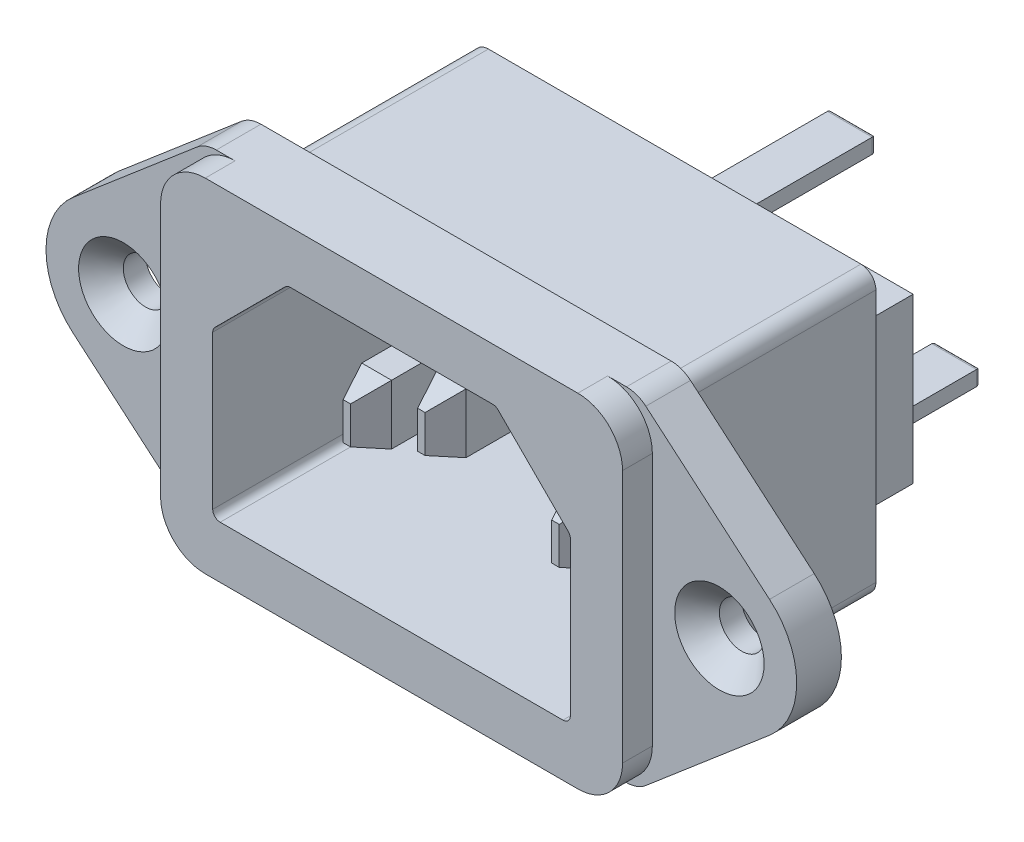
from build123d import *
from OCP.BRepFilletAPI import BRepFilletAPI_MakeChamfer

# Parameters (mm, degrees)
SKIZZE1_R                       = 1.5
AUFSATZ_LINEAR_AUSTRAGEN1_DEPTH = 3
VERRUNDUNG1_R                   = 2
FASE1_SIZE                      = 1.5
AUFSATZ_LINEAR_AUSTRAGEN2_DEPTH = 2
AUFSATZ_LINEAR_AUSTRAGEN3_DEPTH = 14
SCHNITT_LINEAR_AUSTRAGEN1_DEPTH = 17
SKIZZE5_W                       = 24
SKIZZE5_H                       = 11
AUFSATZ_LINEAR_AUSTRAGEN4_DEPTH = 4
SKIZZE6_W                       = 3
SKIZZE6_H                       = 1
AUFSATZ_LINEAR_AUSTRAGEN5_DEPTH = 8
SKIZZE7_W                       = 2
SKIZZE7_H                       = 4
AUFSATZ_LINEAR_AUSTRAGEN6_DEPTH = 13
SKIZZE8_W                       = 2
SKIZZE8_H                       = 4
AUFSATZ_LINEAR_AUSTRAGEN7_DEPTH = 15
FASE2_SIZE                      = 2
FASE2_SIZE2                     = 0.75
VERRUNDUNG2_R                   = 0.25


with BuildPart() as part:
    # Skizze1 → Aufsatz-Linear austragen1 (new body)
    with BuildSketch(Plane.XY):
        with BuildLine():
            ThreePointArc((23.364069952, 3.949125596), (25.187731645, 0), (23.364069952, -3.949125596))
            Line((23.364069952, -3.949125596), (14.5, -11.5))
            Line((14.5, -11.5), (-14.5, -11.5))
            Line((-14.5, -11.5), (-23.364069952, -3.949125596))
            ThreePointArc((-23.364069952, -3.949125596), (-25.187731645, 0), (-23.364069952, 3.949125596))
            Line((-23.364069952, 3.949125596), (-14.5, 11.5))
            Line((-14.5, 11.5), (14.5, 11.5))
            Line((14.5, 11.5), (23.364069952, 3.949125596))
        make_face()
        with Locations((20, 0)):
            Circle(SKIZZE1_R, mode=Mode.SUBTRACT)
        with Locations((-20, 0)):
            Circle(SKIZZE1_R, mode=Mode.SUBTRACT)
    extrude(amount=AUFSATZ_LINEAR_AUSTRAGEN1_DEPTH)

    # Verrundung1
    verrundung1_edges = [part.edges().sort_by_distance(p)[0] for p in [
        (14.5, -11.5, 1.5),
        (-14.5, -11.5, 1.5),
        (-14.5, 11.5, 1.5),
        (14.5, 11.5, 1.5),
    ]]
    fillet(verrundung1_edges, radius=VERRUNDUNG1_R)

    # Fase1
    fase1_edges = [part.edges().sort_by_distance(p)[0] for p in [
        (18.5, 0, 3),
        (-21.5, 0, 3),
    ]]
    chamfer(fase1_edges, length=FASE1_SIZE)

    # Skizze2 → Aufsatz-Linear austragen2 (add)
    with BuildSketch(Plane.XY.offset(3)):
        with BuildLine():
            Line((-12.5, -11.5), (12.5, -11.5))
            ThreePointArc((12.5, -11.5), (14.621320344, -10.621320344), (15.5, -8.5))
            Line((15.5, -8.5), (15.5, 8.5))
            ThreePointArc((15.5, 8.5), (14.621320344, 10.621320344), (12.5, 11.5))
            Line((12.5, 11.5), (-12.5, 11.5))
            ThreePointArc((-12.5, 11.5), (-14.621320344, 10.621320344), (-15.5, 8.5))
            Line((-15.5, 8.5), (-15.5, -8.5))
            ThreePointArc((-15.5, -8.5), (-14.621320344, -10.621320344), (-12.5, -11.5))
        make_face()
    extrude(amount=AUFSATZ_LINEAR_AUSTRAGEN2_DEPTH)

    # Skizze4 → Aufsatz-Linear austragen3 (add)
    with BuildSketch(Plane(origin=(0, 0, 0), x_dir=(-1, 0, 0), z_dir=(0, 0, -1))):
        with BuildLine():
            Line((12.5, -9.5), (-12.5, -9.5))
            ThreePointArc((-12.5, -9.5), (-13.207106781, -9.207106781), (-13.5, -8.5))
            Line((-13.5, -8.5), (-13.5, 8.5))
            ThreePointArc((-13.5, 8.5), (-13.207106781, 9.207106781), (-12.5, 9.5))
            Line((-12.5, 9.5), (12.5, 9.5))
            ThreePointArc((12.5, 9.5), (13.207106781, 9.207106781), (13.5, 8.5))
            Line((13.5, 8.5), (13.5, -8.5))
            ThreePointArc((13.5, -8.5), (13.207106781, -9.207106781), (12.5, -9.5))
        make_face()
    extrude(amount=AUFSATZ_LINEAR_AUSTRAGEN3_DEPTH)

    # Skizze3 → Schnitt-Linear austragen1 (cut)
    with BuildSketch(Plane.XY.offset(5)):
        with BuildLine():
            Line((11.5, -8), (-11.5, -8))
            ThreePointArc((-11.5, -8), (-11.853553391, -7.853553391), (-12, -7.5))
            Line((-12, -7.5), (-12, 2.792893219))
            ThreePointArc((-12, 2.792893219), (-11.961939766, 2.984234935), (-11.853553391, 3.146446609))
            Line((-11.853553391, 3.146446609), (-7.146446609, 7.853553391))
            ThreePointArc((-7.146446609, 7.853553391), (-6.984234935, 7.961939766), (-6.792893219, 8))
            Line((-6.792893219, 8), (6.792893219, 8))
            ThreePointArc((6.792893219, 8), (6.984234935, 7.961939766), (7.146446609, 7.853553391))
            Line((7.146446609, 7.853553391), (11.853553391, 3.146446609))
            ThreePointArc((11.853553391, 3.146446609), (11.961939766, 2.984234935), (12, 2.792893219))
            Line((12, 2.792893219), (12, -7.5))
            ThreePointArc((12, -7.5), (11.853553391, -7.853553391), (11.5, -8))
        make_face()
    extrude(amount=-SCHNITT_LINEAR_AUSTRAGEN1_DEPTH, mode=Mode.SUBTRACT)

    # Skizze5 → Aufsatz-Linear austragen4 (add)
    with BuildSketch(Plane(origin=(0, 0, -14), x_dir=(-1, 0, 0), z_dir=(0, 0, -1))):
        Rectangle(SKIZZE5_W, SKIZZE5_H)
    extrude(amount=AUFSATZ_LINEAR_AUSTRAGEN4_DEPTH)

    # Skizze6 → Aufsatz-Linear austragen5 (add)
    with BuildSketch(Plane(origin=(0, 0, -18), x_dir=(-1, 0, 0), z_dir=(0, 0, -1))):
        with Locations((0, 5)):
            Rectangle(SKIZZE6_W, SKIZZE6_H)
        with Locations((-7, -5)):
            Rectangle(SKIZZE6_W, SKIZZE6_H)
        with Locations((7, -5)):
            Rectangle(SKIZZE6_W, SKIZZE6_H)
    extrude(amount=AUFSATZ_LINEAR_AUSTRAGEN5_DEPTH)

    # Skizze7 → Aufsatz-Linear austragen6 (add)
    with BuildSketch(Plane.XY.offset(-12)):
        with Locations((-7, -2)):
            Rectangle(SKIZZE7_W, SKIZZE7_H)
        with Locations((7, -2)):
            Rectangle(SKIZZE7_W, SKIZZE7_H)
    extrude(amount=AUFSATZ_LINEAR_AUSTRAGEN6_DEPTH)

    # Skizze8 → Aufsatz-Linear austragen7 (add)
    with BuildSketch(Plane.XY.offset(-12)):
        with Locations((0, 2)):
            Rectangle(SKIZZE8_W, SKIZZE8_H)
    extrude(amount=AUFSATZ_LINEAR_AUSTRAGEN7_DEPTH)

    # Fase2: one chamfer whose edges measure the first distance from different faces: ONE call of the kernel's chamfer builder (chamfer() names one face for all edges)
    fase2_edges_1 = [part.edges().sort_by_distance(p)[0] for p in [
        (7, -4, 1),
    ]]
    fase2_side_1 = [part.faces().sort_by_distance(p)[0] for p in [
        (7, -4, -5.5),
    ]]
    fase2_edges_2 = [part.edges().sort_by_distance(p)[0] for p in [
        (6, -2, 1),
    ]]
    fase2_side_2 = [part.faces().sort_by_distance(p)[0] for p in [
        (6, -2, -5.5),
    ]]
    fase2_edges_3 = [part.edges().sort_by_distance(p)[0] for p in [
        (7, 0, 1),
    ]]
    fase2_side_3 = [part.faces().sort_by_distance(p)[0] for p in [
        (7, 0, -5.5),
    ]]
    fase2_edges_4 = [part.edges().sort_by_distance(p)[0] for p in [
        (8, -2, 1),
    ]]
    fase2_side_4 = [part.faces().sort_by_distance(p)[0] for p in [
        (8, -2, -5.5),
    ]]
    fase2_edges_5 = [part.edges().sort_by_distance(p)[0] for p in [
        (0, 0, 3),
    ]]
    fase2_side_5 = [part.faces().sort_by_distance(p)[0] for p in [
        (0, 0, -4.5),
    ]]
    fase2_edges_6 = [part.edges().sort_by_distance(p)[0] for p in [
        (-1, 2, 3),
    ]]
    fase2_side_6 = [part.faces().sort_by_distance(p)[0] for p in [
        (-1, 2, -4.5),
    ]]
    fase2_edges_7 = [part.edges().sort_by_distance(p)[0] for p in [
        (0, 4, 3),
    ]]
    fase2_side_7 = [part.faces().sort_by_distance(p)[0] for p in [
        (0, 4, -4.5),
    ]]
    fase2_edges_8 = [part.edges().sort_by_distance(p)[0] for p in [
        (1, 2, 3),
    ]]
    fase2_side_8 = [part.faces().sort_by_distance(p)[0] for p in [
        (1, 2, -4.5),
    ]]
    fase2_edges_9 = [part.edges().sort_by_distance(p)[0] for p in [
        (-7, 0, 1),
    ]]
    fase2_side_9 = [part.faces().sort_by_distance(p)[0] for p in [
        (-7, 0, -5.5),
    ]]
    fase2_edges_10 = [part.edges().sort_by_distance(p)[0] for p in [
        (-6, -2, 1),
    ]]
    fase2_side_10 = [part.faces().sort_by_distance(p)[0] for p in [
        (-6, -2, -5.5),
    ]]
    fase2_edges_11 = [part.edges().sort_by_distance(p)[0] for p in [
        (-7, -4, 1),
    ]]
    fase2_side_11 = [part.faces().sort_by_distance(p)[0] for p in [
        (-7, -4, -5.5),
    ]]
    fase2_edges_12 = [part.edges().sort_by_distance(p)[0] for p in [
        (-8, -2, 1),
    ]]
    fase2_side_12 = [part.faces().sort_by_distance(p)[0] for p in [
        (-8, -2, -5.5),
    ]]
    fase2 = BRepFilletAPI_MakeChamfer(part.part.solid().wrapped)
    for e in fase2_edges_1:
        fase2.Add(FASE2_SIZE, FASE2_SIZE2, e.wrapped, fase2_side_1[0].wrapped)  # the first distance lies on this face
    for e in fase2_edges_2:
        fase2.Add(FASE2_SIZE, FASE2_SIZE2, e.wrapped, fase2_side_2[0].wrapped)  # the first distance lies on this face
    for e in fase2_edges_3:
        fase2.Add(FASE2_SIZE, FASE2_SIZE2, e.wrapped, fase2_side_3[0].wrapped)  # the first distance lies on this face
    for e in fase2_edges_4:
        fase2.Add(FASE2_SIZE, FASE2_SIZE2, e.wrapped, fase2_side_4[0].wrapped)  # the first distance lies on this face
    for e in fase2_edges_5:
        fase2.Add(FASE2_SIZE, FASE2_SIZE2, e.wrapped, fase2_side_5[0].wrapped)  # the first distance lies on this face
    for e in fase2_edges_6:
        fase2.Add(FASE2_SIZE, FASE2_SIZE2, e.wrapped, fase2_side_6[0].wrapped)  # the first distance lies on this face
    for e in fase2_edges_7:
        fase2.Add(FASE2_SIZE, FASE2_SIZE2, e.wrapped, fase2_side_7[0].wrapped)  # the first distance lies on this face
    for e in fase2_edges_8:
        fase2.Add(FASE2_SIZE, FASE2_SIZE2, e.wrapped, fase2_side_8[0].wrapped)  # the first distance lies on this face
    for e in fase2_edges_9:
        fase2.Add(FASE2_SIZE, FASE2_SIZE2, e.wrapped, fase2_side_9[0].wrapped)  # the first distance lies on this face
    for e in fase2_edges_10:
        fase2.Add(FASE2_SIZE, FASE2_SIZE2, e.wrapped, fase2_side_10[0].wrapped)  # the first distance lies on this face
    for e in fase2_edges_11:
        fase2.Add(FASE2_SIZE, FASE2_SIZE2, e.wrapped, fase2_side_11[0].wrapped)  # the first distance lies on this face
    for e in fase2_edges_12:
        fase2.Add(FASE2_SIZE, FASE2_SIZE2, e.wrapped, fase2_side_12[0].wrapped)  # the first distance lies on this face
    add(Compound.cast(fase2.Shape()), mode=Mode.REPLACE)

    # Verrundung2
    verrundung2_edges = [part.edges().sort_by_distance(p)[0] for p in [
        (1.5, 5, -26),
        (0, 4.5, -26),
        (-1.5, 5, -26),
        (0, 5.5, -26),
        (5.5, -5, -26),
        (7, -4.5, -26),
        (8.5, -5, -26),
        (7, -5.5, -26),
        (-5.5, -5, -26),
        (-7, -5.5, -26),
        (-8.5, -5, -26),
        (-7, -4.5, -26),
    ]]
    fillet(verrundung2_edges, radius=VERRUNDUNG2_R)


solid = part.part
